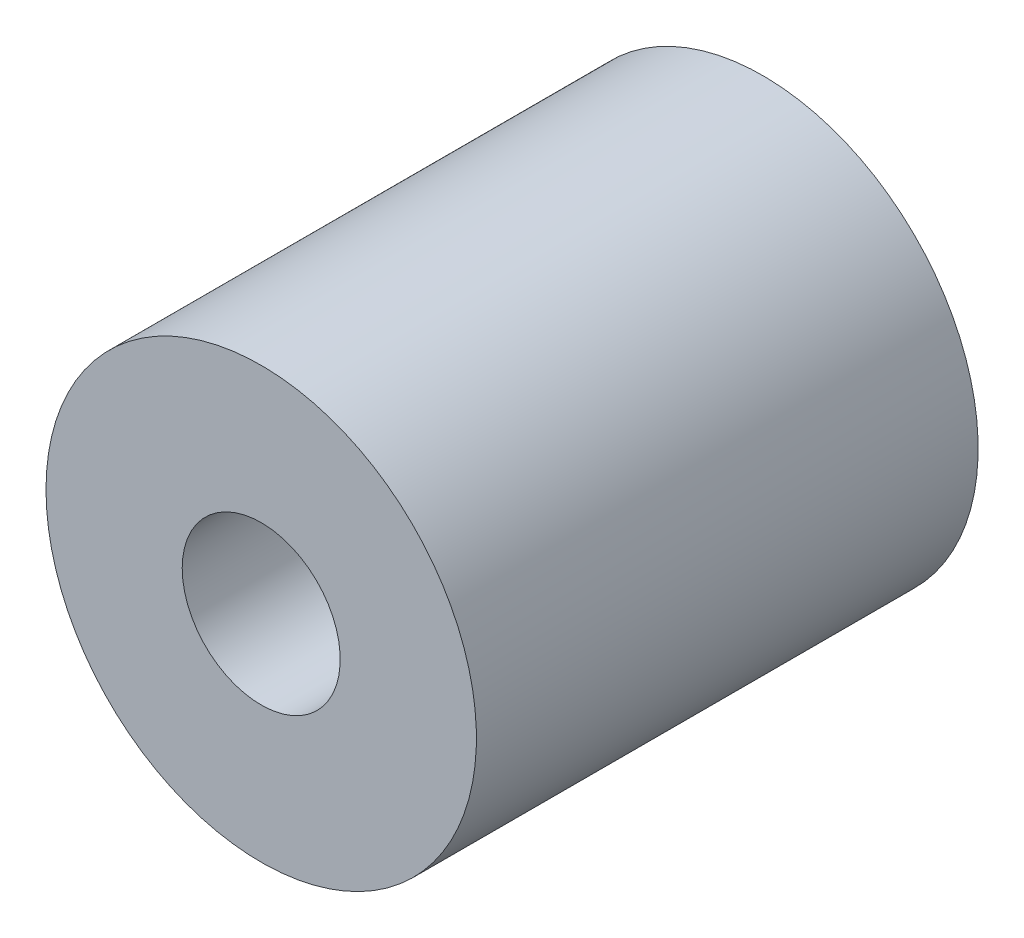
from build123d import *

# Parameters (mm, degrees)
SKETCH1_W = 20.7264
SKETCH1_H = 5.6261


with BuildPart() as part:
    # Sketch1 → Revolve1 (revolve)
    with BuildSketch(Plane(origin=(0, 0, 0), x_dir=(0, 0, -1), z_dir=(1, 0, 0)), mode=Mode.PRIVATE) as revolve1_sk:
        with Locations((0, 6.07695)):
            Rectangle(SKETCH1_W, SKETCH1_H)
    revolve(revolve1_sk.sketch.rotate(Axis((0, 0, -21.730881676), (0, 0, 1)), 90), axis=Axis((0, 0, -21.730881676), (0, 0, 1)))


solid = part.part
